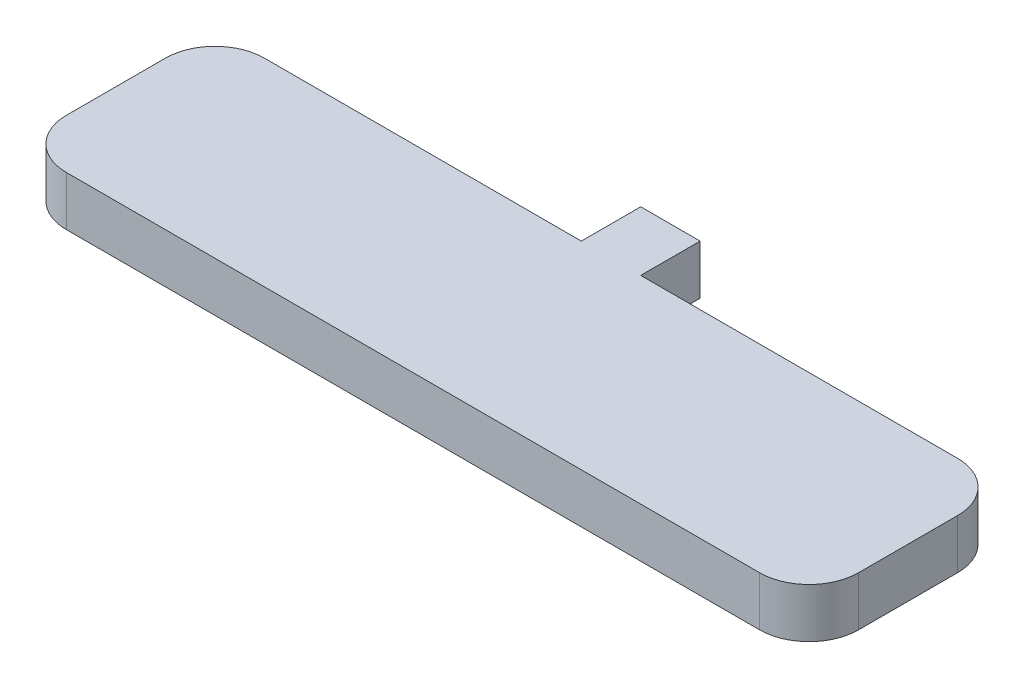
from build123d import *

# Parameters (mm, degrees)
SKETCH1_W           = 80
SKETCH1_H           = 20
BOSS_EXTRUDE1_DEPTH = 5
FILLET1_R           = 5
SHELL1_T            = -2
SKETCH2_W           = 6
SKETCH2_H           = 5
BOSS_EXTRUDE2_DEPTH = 6
SKETCH3_R           = 1.425
CUT_EXTRUDE1_DEPTH  = 4


with BuildPart() as part:
    # Sketch1 → Boss-Extrude1 (new body)
    with BuildSketch(Plane(origin=(0, 0, 0), x_dir=(1, 0, 0), z_dir=(0, 1, 0))):
        Rectangle(SKETCH1_W, SKETCH1_H)
    extrude(amount=BOSS_EXTRUDE1_DEPTH)

    # Fillet1
    fillet1_edges = [part.edges().sort_by_distance(p)[0] for p in [
        (40, 2.5, 10),
        (-40, 2.5, 10),
        (-40, 2.5, -10),
        (40, 2.5, -10),
    ]]
    fillet(fillet1_edges, radius=FILLET1_R)

    # Shell1
    shell1_openings = [part.faces().sort_by_distance(p)[0] for p in [
        (0, 0, 0),
    ]]
    offset(amount=SHELL1_T, openings=shell1_openings, kind=Kind.INTERSECTION)

    # Sketch2 → Boss-Extrude2 (add)
    with BuildSketch(Plane(origin=(0, 0, -10), x_dir=(-1, 0, 0), z_dir=(0, 0, -1))):
        with Locations((0, 2.5)):
            Rectangle(SKETCH2_W, SKETCH2_H)
    extrude(amount=BOSS_EXTRUDE2_DEPTH)

    # Sketch3 → Cut-Extrude1 (cut)
    with BuildSketch(Plane(origin=(0, 0, -16), x_dir=(-1, 0, 0), z_dir=(0, 0, -1))):
        with Locations((0, 2.5)):
            Circle(SKETCH3_R)
    extrude(amount=-CUT_EXTRUDE1_DEPTH, mode=Mode.SUBTRACT)


solid = part.part
